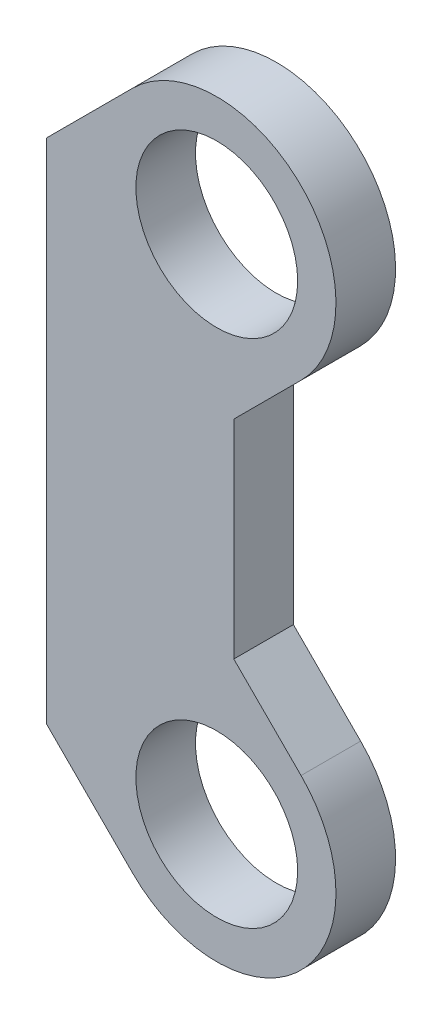
from build123d import *

# Parameters (mm, degrees)
CROQUIS1_R              = 7
CROQUIS1_R_2            = 4.75
SALIENTE_EXTRUIR1_DEPTH = 3.5
CROQUIS4_W              = 8.235883517
CROQUIS4_H              = 32.578937154
CORTAR_EXTRUIR4_DEPTH   = 4


with BuildPart() as part:
    # Croquis1 → Saliente-Extruir1 (new body)
    # profile 1 of 3: a face of its own
    with BuildSketch(Plane.XY):
        with BuildLine():
            ThreePointArc((-4.949747468, -4.949747468), (-4.949747468, 4.949747468), (4.949747468, 4.949747468))
            Line((4.949747468, 4.949747468), (1, 8.899494937))
            Line((1, 8.899494937), (1, 21.100505063))
            Line((1, 21.100505063), (4.949747468, 25.050252532))
            ThreePointArc((4.949747468, 25.050252532), (-4.949747468, 25.050252532), (-4.949747468, 34.949747468))
            Line((-4.949747468, 34.949747468), (-13, 26.899494937))
            Line((-13, 26.899494937), (-13, 3.100505063))
            Line((-13, 3.100505063), (-4.949747468, -4.949747468))
        make_face()
    # profile 2 of 3: a face of its own
    with BuildSketch(Plane.XY):
        with Locations((0, 30)):
            Circle(CROQUIS1_R)
        with Locations((0, 30)):
            Circle(CROQUIS1_R_2, mode=Mode.SUBTRACT)
    # profile 3 of 3: a face of its own
    with BuildSketch(Plane.XY):
        Circle(CROQUIS1_R)
        Circle(CROQUIS1_R_2, mode=Mode.SUBTRACT)
    extrude(amount=SALIENTE_EXTRUIR1_DEPTH)

    # Croquis4 → Cortar-Extruir4 (cut)
    with BuildSketch(Plane.XY.offset(3.5)):
        with Locations((-14.117941759, 13.61002636)):
            Rectangle(CROQUIS4_W, CROQUIS4_H)
    extrude(amount=-CORTAR_EXTRUIR4_DEPTH, mode=Mode.SUBTRACT)


solid = part.part
